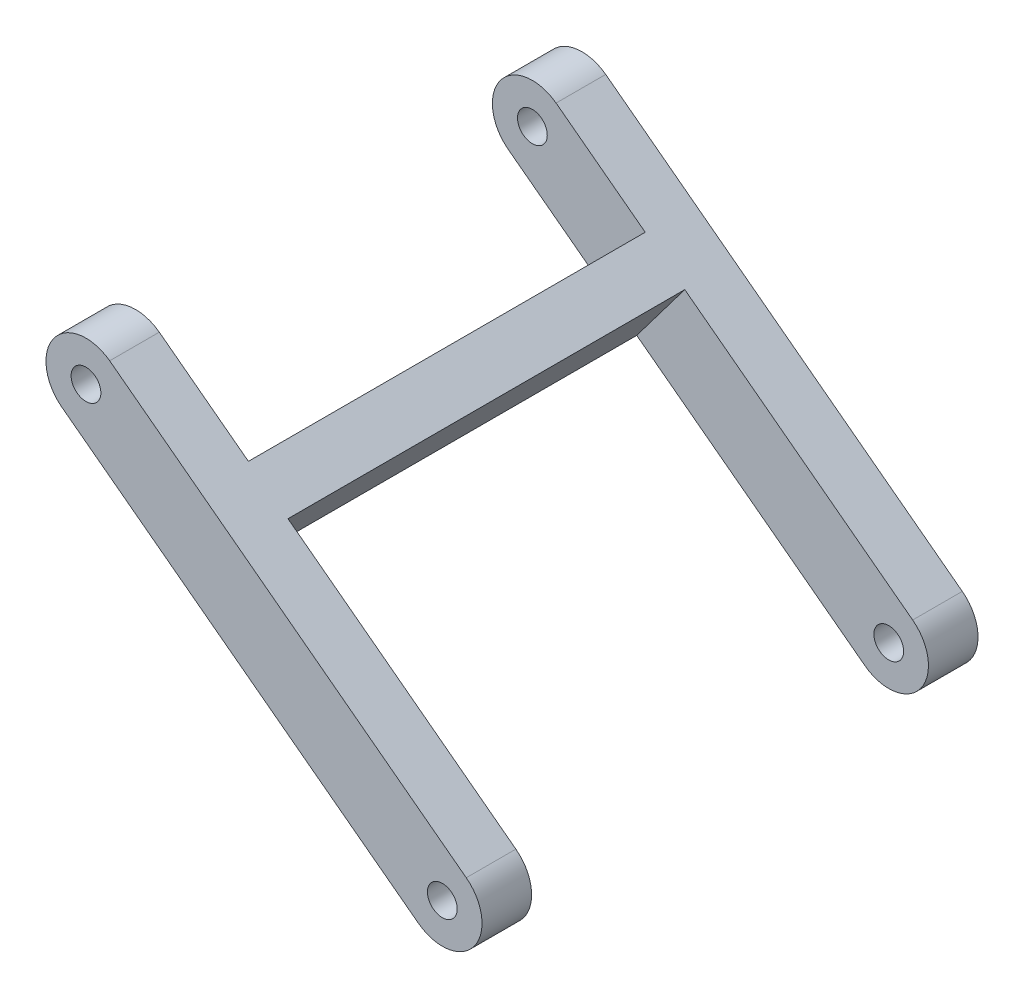
from build123d import *

# Parameters (mm, degrees)
ESQUISSE1_R        = 1.5
BOSS_EXTRU_1_DEPTH = 5
BOSS_EXTRU_2_DEPTH = 20


with BuildPart() as part:
    # Esquisse1 → Boss.-Extru.1 (new body)
    with BuildSketch(Plane.XY):
        with BuildLine():
            Line((2.411392109, 3.191424149), (-33.53228234, 30.349924212))
            ThreePointArc((-33.53228234, 30.349924212), (-39.142258528, 29.531111427), (-38.389494778, 23.911891379))
            Line((-38.389494778, 23.911891379), (-2.406799918, -3.194888755))
            ThreePointArc((-2.406799918, -3.194888755), (3.193157277, -2.409096636), (2.411392109, 3.191424149))
        make_face()
        with Locations((-35.923019369, 27.102337158)):
            Circle(ESQUISSE1_R, mode=Mode.SUBTRACT)
        Circle(ESQUISSE1_R, mode=Mode.SUBTRACT)
    boss_extru_1 = extrude(amount=BOSS_EXTRU_1_DEPTH)

    # Esquisse2 → Boss.-Extru.2 (add)
    with BuildSketch(Plane(origin=(0, 0, 0), x_dir=(-1, 0, 0), z_dir=(0, 0, -1))):
        Polygon((20.560906603, 20.548947707), (25.40403733, 14.129579595), (29.397447291, 17.137928086), (24.549986024, 23.563036149), align=None)
    boss_extru_2 = extrude(amount=BOSS_EXTRU_2_DEPTH)

    # Symétrie1: Boss.-Extru.1, Boss.-Extru.2 across plane
    add(boss_extru_1.mirror(Plane.XY.offset(-20)))
    add(boss_extru_2.mirror(Plane.XY.offset(-20)))


solid = part.part
